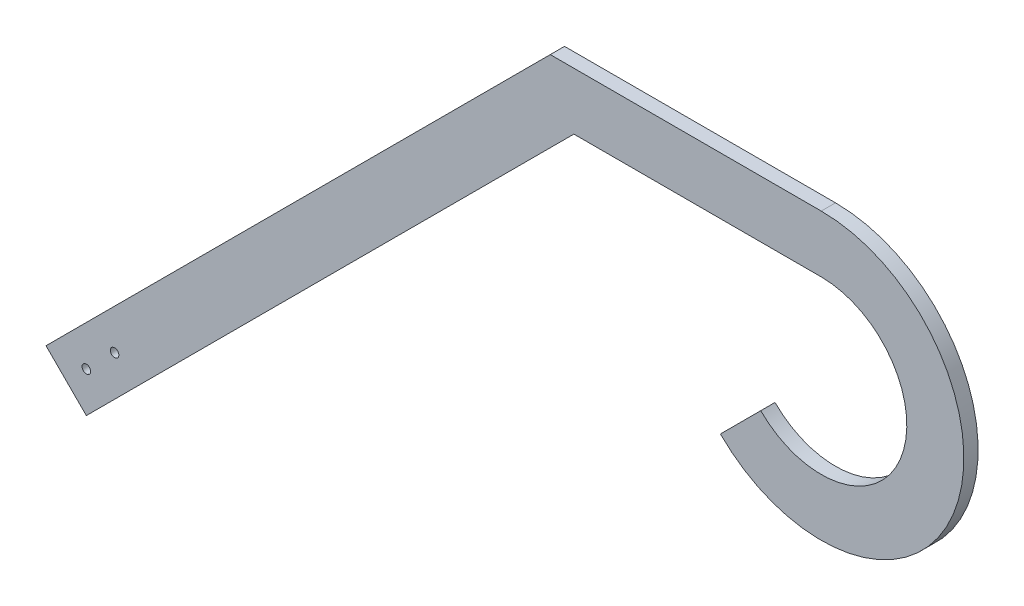
from build123d import *

# Parameters (mm, degrees)
EXTRUDE_1_DEPTH     = 5
SKETCH_2_R          = 1.5
CUT_EXTRUDE_1_DEPTH = 307.179177957


with BuildPart() as part:
    # 草图1 → 凸台-拉伸1 (new body)
    with BuildSketch(Plane.XY):
        with BuildLine():
            Line((0, 50), (-95, 50))
            Line((-95, 50), (-271.776695297, -126.776695297))
            Line((-271.776695297, -126.776695297), (-257.634559673, -140.91883092))
            Line((-257.634559673, -140.91883092), (-86.715728753, 30))
            Line((-86.715728753, 30), (0, 30))
            ThreePointArc((0, 30), (27.716385975, -11.480502971), (-21.213203436, -21.213203436))
            Line((-21.213203436, -21.213203436), (-35.355339059, -35.355339059))
            ThreePointArc((-35.355339059, -35.355339059), (46.193976626, -19.134171618), (0, 50))
        make_face()
    extrude(amount=EXTRUDE_1_DEPTH)

    # 草图2 → 切除-拉伸1 (cut, through all)
    with BuildSketch(Plane.XY.offset(5)):
        with Locations((-257.634559673, -126.776695297)):
            Circle(SKETCH_2_R)
        with Locations((-247.735064736, -116.87720036)):
            Circle(SKETCH_2_R)
    extrude(amount=-CUT_EXTRUDE_1_DEPTH, mode=Mode.SUBTRACT)


solid = part.part
